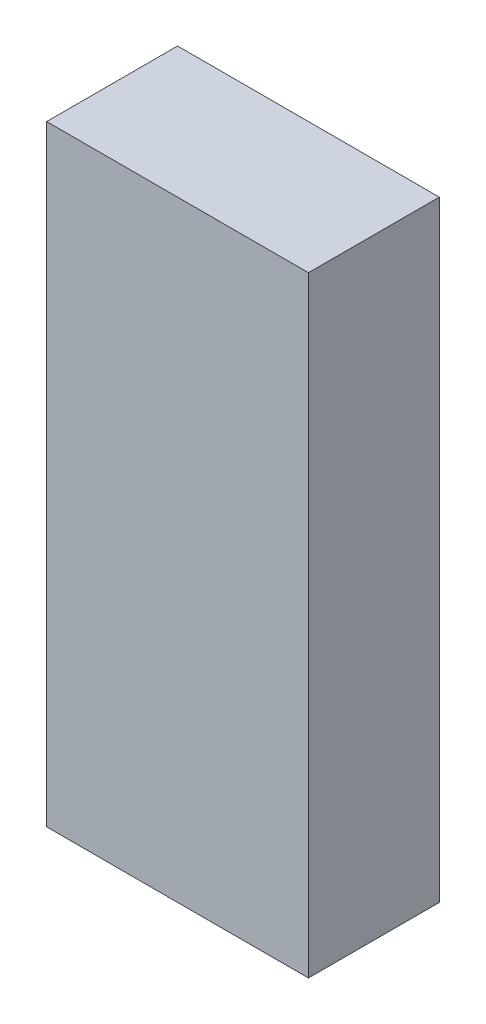
from build123d import *

# Parameters (mm, degrees)
SKETCH1_W           = 76.2
SKETCH1_H           = 38.1
BOSS_EXTRUDE1_DEPTH = 177.8


with BuildPart() as part:
    # Sketch1 → Boss-Extrude1 (new body)
    with BuildSketch(Plane(origin=(0, 0, 0), x_dir=(1, 0, 0), z_dir=(0, 1, 0))):
        Rectangle(SKETCH1_W, SKETCH1_H)
    extrude(amount=BOSS_EXTRUDE1_DEPTH)


solid = part.part
